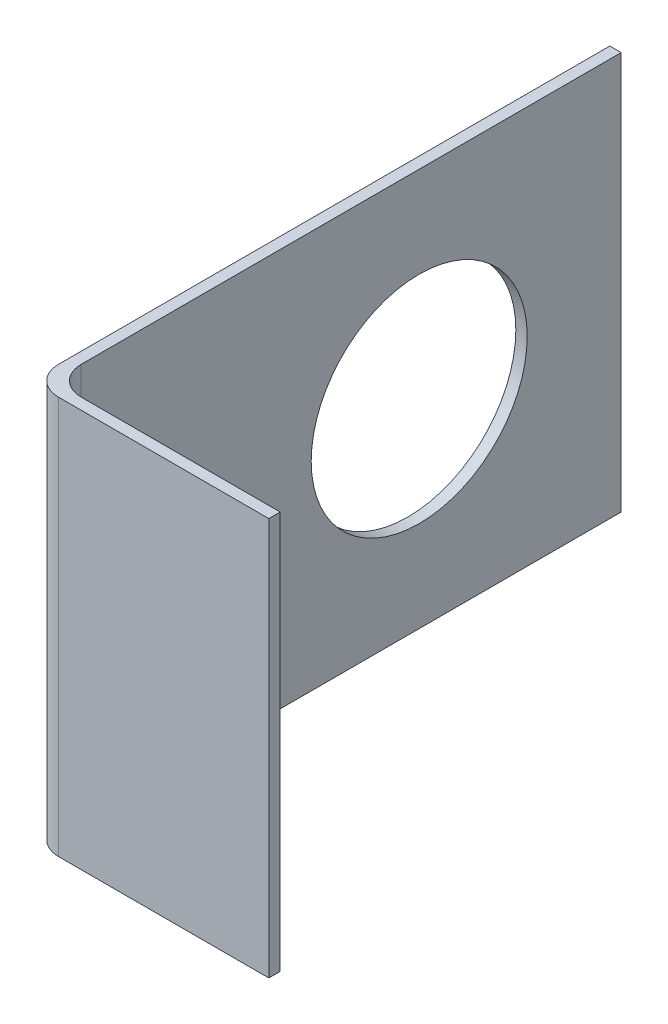
from build123d import *

# Parameters (mm, degrees)
BOSS_EXTRUDE1_DEPTH = 70
SKETCH2_R           = 19
CUT_EXTRUDE1_DEPTH  = 108.956316041
FILLET1_R           = 5


with BuildPart() as part:
    # Sketch1 → Boss-Extrude1 (new body)
    with BuildSketch(Plane(origin=(0, 0, 0), x_dir=(1, 0, 0), z_dir=(0, 1, 0))):
        Polygon((-37.290686498, 31.356060606), (-35.290686498, 31.356060606), (-35.290686498, -68.643939394), (4.709313502, -68.643939394), (4.709313502, -70.643939394), (-37.290686498, -70.643939394), align=None)
    extrude(amount=BOSS_EXTRUDE1_DEPTH)

    # Sketch2 → Cut-Extrude1 (cut, through all)
    with BuildSketch(Plane.ZY.offset(37.290686498)):
        with Locations((4.183939394, 35)):
            Circle(SKETCH2_R)
    extrude(amount=-CUT_EXTRUDE1_DEPTH, mode=Mode.SUBTRACT)

    # Fillet1
    fillet1_edges = [part.edges().sort_by_distance(p)[0] for p in [
        (-35.290686498, 35, 68.643939394),
        (-37.290686498, 35, 70.643939394),
    ]]
    fillet(fillet1_edges, radius=FILLET1_R)


solid = part.part
